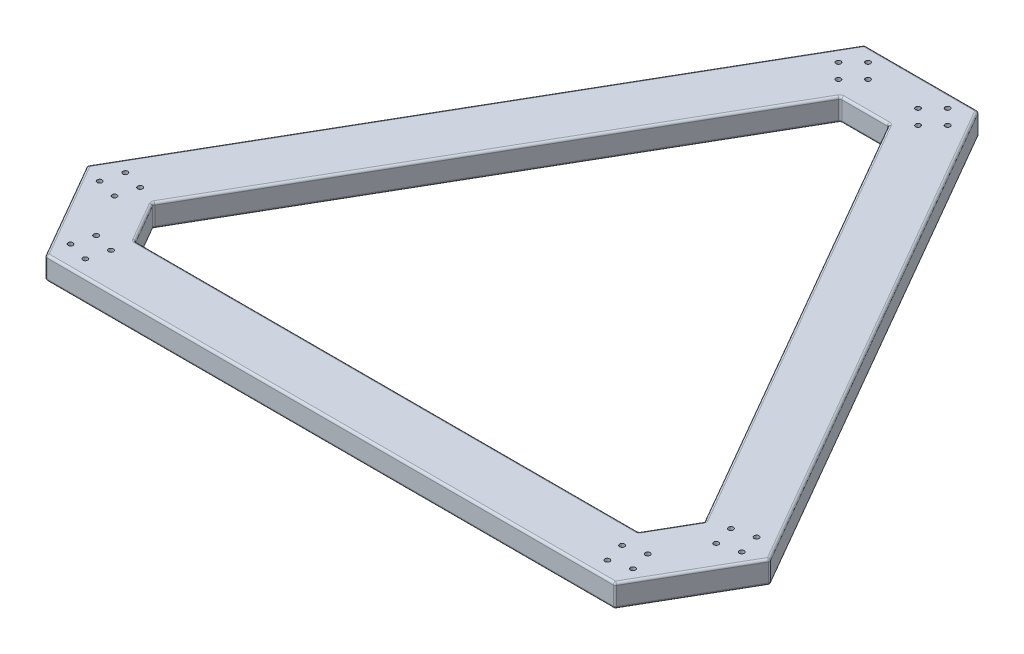
from build123d import *

# Parameters (mm, degrees)
BOSS_EXTRUDE1_DEPTH  = 20
SKETCH1_3_R          = 18
CUT_EXTRUDE1_DEPTH   = 10
CUT_EXTRUDE2_DEPTH   = 438.3023363
FILLET1_R            = 2
M4_CLEARANCE_HOLE1_D = 4.3


with BuildPart() as part:
    # Sketch1 → Boss-Extrude1 (new body)
    with BuildSketch(Plane(origin=(0, 0, 0), x_dir=(1, 0, 0), z_dir=(0, 1, 0))):
        Polygon((50, 317.542648054), (-50, 317.542648054), (-300, -115.470053838), (-250, -202.072594216), (250, -202.072594216), (300, -115.470053838), align=None)
    extrude(amount=BOSS_EXTRUDE1_DEPTH)

    # Sketch1<3> → Cut-Extrude1 (cut)
    with BuildSketch(Plane(origin=(0, 0, 0), x_dir=(1, 0, 0), z_dir=(0, 1, 0))):
        with Locations((-270.849364905, -115.960434895)):
            Circle(SKETCH1_3_R)
        with Locations((-235.849364905, -176.58221316)):
            Circle(SKETCH1_3_R)
        with Locations((-35, 292.542648054)):
            Circle(SKETCH1_3_R)
        with Locations((35, 292.542648054)):
            Circle(SKETCH1_3_R)
        with Locations((270.849364905, -115.960434895)):
            Circle(SKETCH1_3_R)
        with Locations((235.849364905, -176.58221316)):
            Circle(SKETCH1_3_R)
    extrude(amount=CUT_EXTRUDE1_DEPTH, mode=Mode.SUBTRACT)

    # Sketch2 → Cut-Extrude2 (cut, through all)
    with BuildSketch(Plane.XZ):
        Polygon((-242.264973081, 115.470053838), (-221.132486541, 152.072594216), (221.132486541, 152.072594216), (242.264973081, 115.470053838), (21.132486541, -267.542648054), (-21.132486541, -267.542648054), align=None)
    extrude(amount=-CUT_EXTRUDE2_DEPTH, mode=Mode.SUBTRACT)

    # Fillet1
    fillet1_edges = [part.edges().sort_by_distance(p)[0] for p in [
        (0, 20, -317.542648054),
        (175, 20, -101.036297108),
        (275, 20, 158.771324027),
        (0, 20, 202.072594216),
        (-275, 20, 158.771324027),
        (-175, 20, -101.036297108),
        (-231.698729811, 20, 133.771324027),
        (0, 20, 152.072594216),
        (231.698729811, 20, 133.771324027),
        (131.698729811, 20, -76.036297108),
        (0, 20, -267.542648054),
        (-131.698729811, 20, -76.036297108),
        (-53, 0, -292.542648054),
        (252.849364905, 0, 115.960434895),
        (-253.849364905, 0, 176.58221316),
        (-275, 0, 158.771324027),
        (0, 0, 202.072594216),
        (275, 0, 158.771324027),
        (175, 0, -101.036297108),
        (0, 0, -317.542648054),
        (-175, 0, -101.036297108),
        (-288.849364905, 0, 115.960434895),
        (217.849364905, 0, 176.58221316),
        (17, 0, -292.542648054),
        (131.698729811, 0, -76.036297108),
        (231.698729811, 0, 133.771324027),
        (0, 0, 152.072594216),
        (-231.698729811, 0, 133.771324027),
        (-131.698729811, 0, -76.036297108),
        (0, 0, -267.542648054),
        (21.132486541, 10, -267.542648054),
        (-21.132486541, 10, -267.542648054),
        (242.264973081, 10, 115.470053838),
        (221.132486541, 10, 152.072594216),
        (-221.132486541, 10, 152.072594216),
        (-242.264973081, 10, 115.470053838),
        (250, 10, 202.072594216),
        (300, 10, 115.470053838),
        (50, 10, -317.542648054),
        (-50, 10, -317.542648054),
        (-250, 10, 202.072594216),
        (-300, 10, 115.470053838),
    ]]
    fillet(fillet1_edges, radius=FILLET1_R)

    # M4 Clearance Hole1 (through all)
    with Locations(Plane(origin=(0, 10, 0), x_dir=(-1, 0, 0), z_dir=(0, -1, 0))):
        with Locations((-35, 279.542648054), (-35, 305.542648054), (-48, 292.542648054), (-22, 292.542648054), (35, 279.542648054), (35, 305.542648054), (22, 292.542648054), (48, 292.542648054), (264.349364905, -127.218765144), (277.349364905, -104.702104645), (259.591034656, -109.460434895), (282.107695155, -122.460434895), (229.349364905, -187.840543409), (247.107695155, -183.08221316), (224.591034656, -170.08221316), (242.349364905, -165.32388291), (-247.107695155, -183.08221316), (-224.591034656, -170.08221316), (-229.349364905, -187.840543409), (-242.349364905, -165.32388291), (-259.591034656, -109.460434895), (-277.349364905, -104.702104645), (-264.349364905, -127.218765144), (-282.107695155, -122.460434895)):
            Hole(M4_CLEARANCE_HOLE1_D / 2)


solid = part.part
